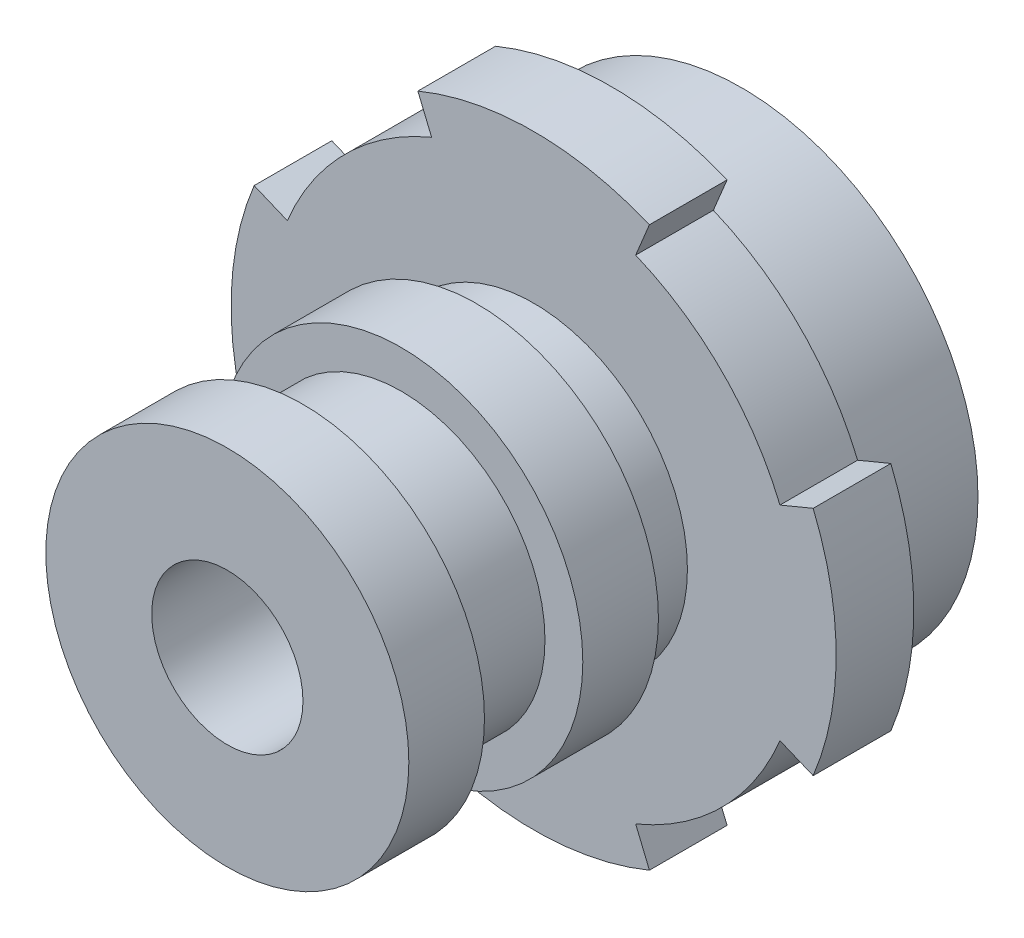
from build123d import *

# Parameters (mm, degrees)
TAGLIO_ESTRUSIONE1_DEPTH    = 153.019930179
RIPETIZIONECIRCOLARE1_COUNT = 4


with BuildPart() as part:
    # Schizzo1 → Rivoluzione1 (revolve)
    with BuildSketch(Plane(origin=(0, 0, 0), x_dir=(0, 0, -1), z_dir=(1, 0, 0)), mode=Mode.PRIVATE) as rivoluzione1_sk:
        Polygon((-40.820512821, 20), (65.179487179, 20), (65.179487179, 48), (95.179487179, 48), (95.179487179, 62.5), (60.717948718, 62.5), (60.717948718, 80), (40.179487179, 80), (40.179487179, 40.666666667), (25.179487179, 40.666666667), (25.179487179, 48), (5.179487179, 48), (5.179487179, 38), (-20.820512821, 38), (-20.820512821, 48), (-40.820512821, 48), align=None)
    revolve(rivoluzione1_sk.sketch.rotate(Axis((0, 0, 49.025641026), (0, 0, -1)), 90), axis=Axis((0, 0, 49.025641026), (0, 0, -1)))

    # Schizzo2 → Taglio-Estrusione1 (cut, through all)
    with BuildSketch(Plane(origin=(0, 0, -60.717948718), x_dir=(-1, 0, 0), z_dir=(0, 0, -1))):
        with BuildLine():
            ThreePointArc((26.979181982, 65.133507042), (49.851028074, 49.851028074), (65.133507042, 26.979181982))
            Line((65.133507042, 26.979181982), (73.910362601, 30.614674589))
            ThreePointArc((73.910362601, 30.614674589), (56.568542495, 56.568542495), (30.614674589, 73.910362601))
            Line((30.614674589, 73.910362601), (26.979181982, 65.133507042))
        make_face()
    taglio_estrusione1 = extrude(amount=-TAGLIO_ESTRUSIONE1_DEPTH, mode=Mode.SUBTRACT)

    # RipetizioneCircolare1: Taglio-Estrusione1 ×4 about axis
    ripetizionecircolare1_axis = Axis((0, 0, 49.025641026), (0, 0, 1))
    for i in range(1, RIPETIZIONECIRCOLARE1_COUNT):
        add(taglio_estrusione1.rotate(ripetizionecircolare1_axis, i * 360 / RIPETIZIONECIRCOLARE1_COUNT), mode=Mode.SUBTRACT)


solid = part.part
